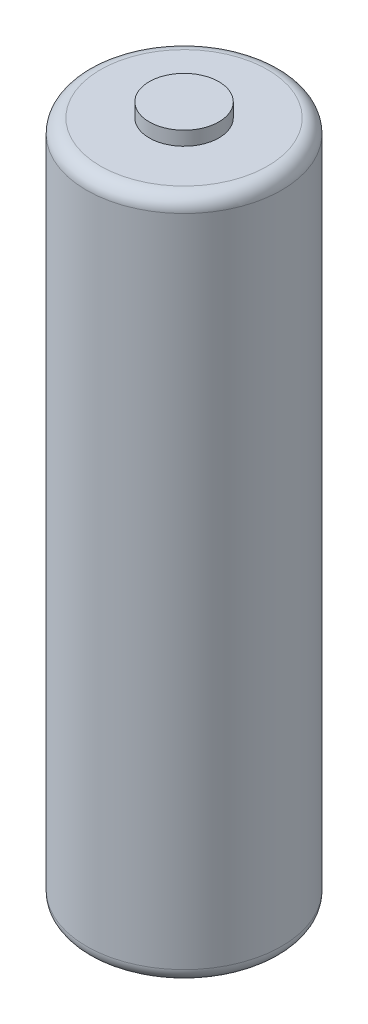
from build123d import *

# Parameters (mm, degrees)
SKETCH_1_R      = 7
EXTRUDE_1_DEPTH = 49
SKETCH_2_R      = 2.5
EXTRUDE_2_DEPTH = 1
FILLET_1_R      = 1


with BuildPart() as part:
    # 草图1 → 凸台-拉伸1 (new body)
    with BuildSketch(Plane(origin=(0, 0, 0), x_dir=(1, 0, 0), z_dir=(0, 1, 0))):
        with Locations(Location((0, 0, 0), (0, 0, 270))):
            Circle(SKETCH_1_R)
    extrude(amount=EXTRUDE_1_DEPTH)

    # 草图2 → 凸台-拉伸2 (add)
    with BuildSketch(Plane(origin=(0, 49, 0), x_dir=(1, 0, 0), z_dir=(0, 1, 0))):
        with Locations(Location((0, 0, 0), (0, 0, 270))):
            Circle(SKETCH_2_R)
    extrude(amount=EXTRUDE_2_DEPTH)

    # 圆角1
    fillet_1_edges = [part.edges().sort_by_distance(p)[0] for p in [
        (0, 0, -7),
        (0, 49, -7),
    ]]
    fillet(fillet_1_edges, radius=FILLET_1_R)


solid = part.part
